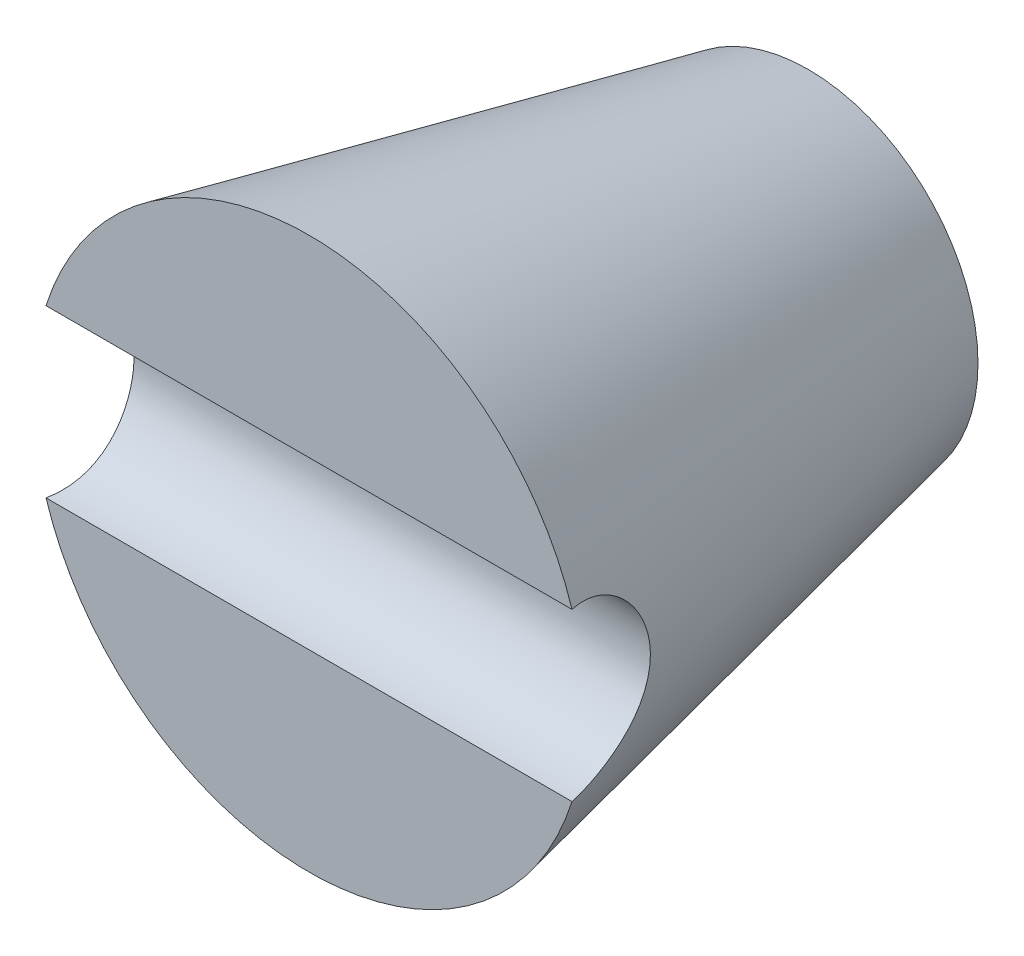
from build123d import *

# Parameters (mm, degrees)
SKETCH1_R               = 30.595
BOSS_EXTRUDE1_DEPTH     = 90
BOSS_EXTRUDE1_DRAFT     = -12
SKETCH2_R               = 15
CUT_EXTRUDE1_DEPTH      = 50
CUT_EXTRUDE4_DEPTH      = 115.215451058
CUT_EXTRUDE4_DEPTH_BACK = 115.215451058
SKETCH3_R               = 15


with BuildPart() as part:
    # Sketch1 → Boss-Extrude1 (with draft: the straight prism first)
    with BuildSketch(Plane.XY):
        Circle(SKETCH1_R)
    extrude(amount=BOSS_EXTRUDE1_DEPTH)
    # Boss-Extrude1: the draft: its side faces are tilted about the plane it starts from
    boss_extrude1_sides = [part.faces().sort_by_distance(p)[0] for p in [
        (-30.595, 0, 45),
    ]]
    draft(boss_extrude1_sides, Plane.XY, BOSS_EXTRUDE1_DRAFT)

    # Sketch2 → Cut-Extrude1 (cut)
    with BuildSketch(Plane(origin=(0, 0, 0), x_dir=(-1, 0, 0), z_dir=(0, 0, -1))):
        Circle(SKETCH2_R)
    extrude(amount=-CUT_EXTRUDE1_DEPTH, mode=Mode.SUBTRACT)

    # Sketch3 → Cut-Extrude4 (cut, two sides: drawn at the far end of the back side and taken through both)
    with BuildSketch(Plane(origin=(0, 0, 0), x_dir=(0, 0, -1), z_dir=(1, 0, 0)).offset(-CUT_EXTRUDE4_DEPTH_BACK)):
        with Locations((-90, 0)):
            Circle(SKETCH3_R)
    extrude(amount=CUT_EXTRUDE4_DEPTH + CUT_EXTRUDE4_DEPTH_BACK, mode=Mode.SUBTRACT)


solid = part.part
